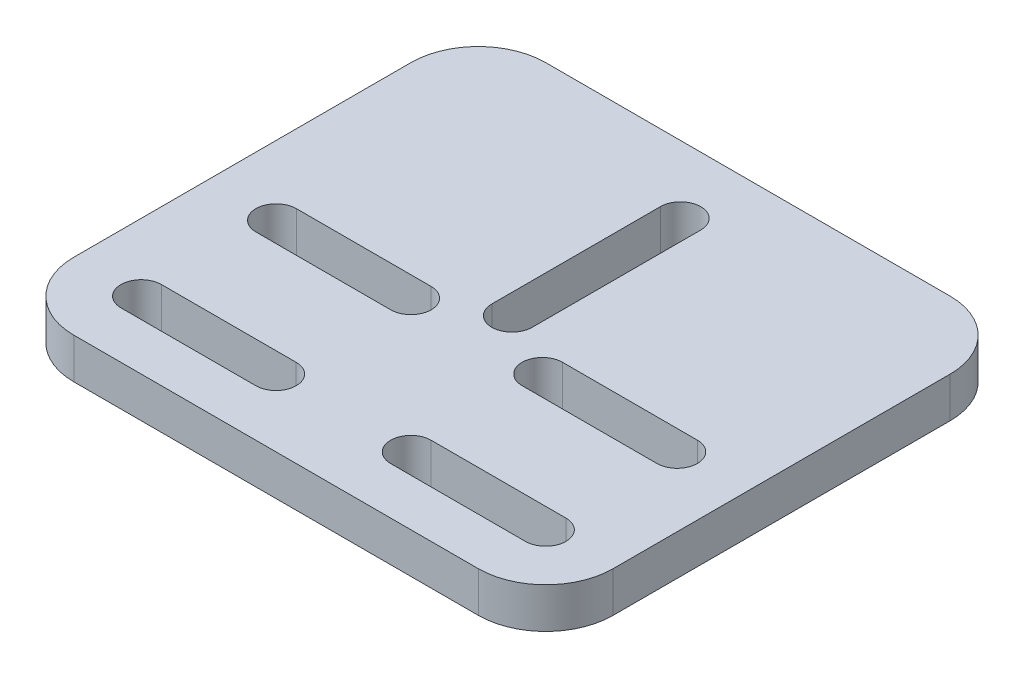
from build123d import *

# Parameters (mm, degrees)
EXTRUDE_1_DEPTH = 3


with BuildPart() as part:
    # 草图1 → 凸台-拉伸1 (new body)
    with BuildSketch(Plane(origin=(0, 0, 0), x_dir=(1, 0, 0), z_dir=(0, 1, 0))):
        with BuildLine():
            Line((-15, 17.5), (15, 17.5))
            ThreePointArc((15, 17.5), (18.535533906, 16.035533906), (20, 12.5))
            Line((20, 12.5), (20, -12.5))
            ThreePointArc((20, -12.5), (18.535533906, -16.035533906), (15, -17.5))
            Line((15, -17.5), (-15, -17.5))
            ThreePointArc((-15, -17.5), (-18.535533906, -16.035533906), (-20, -12.5))
            Line((-20, -12.5), (-20, 12.5))
            ThreePointArc((-20, 12.5), (-18.535533906, 16.035533906), (-15, 17.5))
        make_face()
        with BuildLine():
            Line((5, -11), (15, -11))
            ThreePointArc((15, -11), (16.5, -12.5), (15, -14))
            Line((15, -14), (5, -14))
            ThreePointArc((5, -14), (3.5, -12.5), (5, -11))
        make_face(mode=Mode.SUBTRACT)
        with BuildLine():
            Line((-15, -14), (-5, -14))
            ThreePointArc((-5, -14), (-3.5, -12.5), (-5, -11))
            Line((-5, -11), (-15, -11))
            ThreePointArc((-15, -11), (-16.5, -12.5), (-15, -14))
        make_face(mode=Mode.SUBTRACT)
        with BuildLine():
            Line((-14.869936395, -1.121838378), (-4.869936395, -1.121838378))
            ThreePointArc((-4.869936395, -1.121838378), (-3.369936395, -2.621838378), (-4.869936395, -4.121838378))
            Line((-4.869936395, -4.121838378), (-14.869936395, -4.121838378))
            ThreePointArc((-14.869936395, -4.121838378), (-16.369936395, -2.621838378), (-14.869936395, -1.121838378))
        make_face(mode=Mode.SUBTRACT)
        with BuildLine():
            Line((4.869936395, -4.121838378), (14.869936395, -4.121838378))
            ThreePointArc((14.869936395, -4.121838378), (16.369936395, -2.621838378), (14.869936395, -1.121838378))
            Line((14.869936395, -1.121838378), (4.869936395, -1.121838378))
            ThreePointArc((4.869936395, -1.121838378), (3.369936395, -2.621838378), (4.869936395, -4.121838378))
        make_face(mode=Mode.SUBTRACT)
        with BuildLine():
            Line((-1.5, 12.5), (-1.5, 0))
            ThreePointArc((-1.5, 0), (0, -1.5), (1.5, 0))
            Line((1.5, 0), (1.5, 12.5))
            ThreePointArc((1.5, 12.5), (0, 14), (-1.5, 12.5))
        make_face(mode=Mode.SUBTRACT)
    extrude(amount=EXTRUDE_1_DEPTH)


solid = part.part
